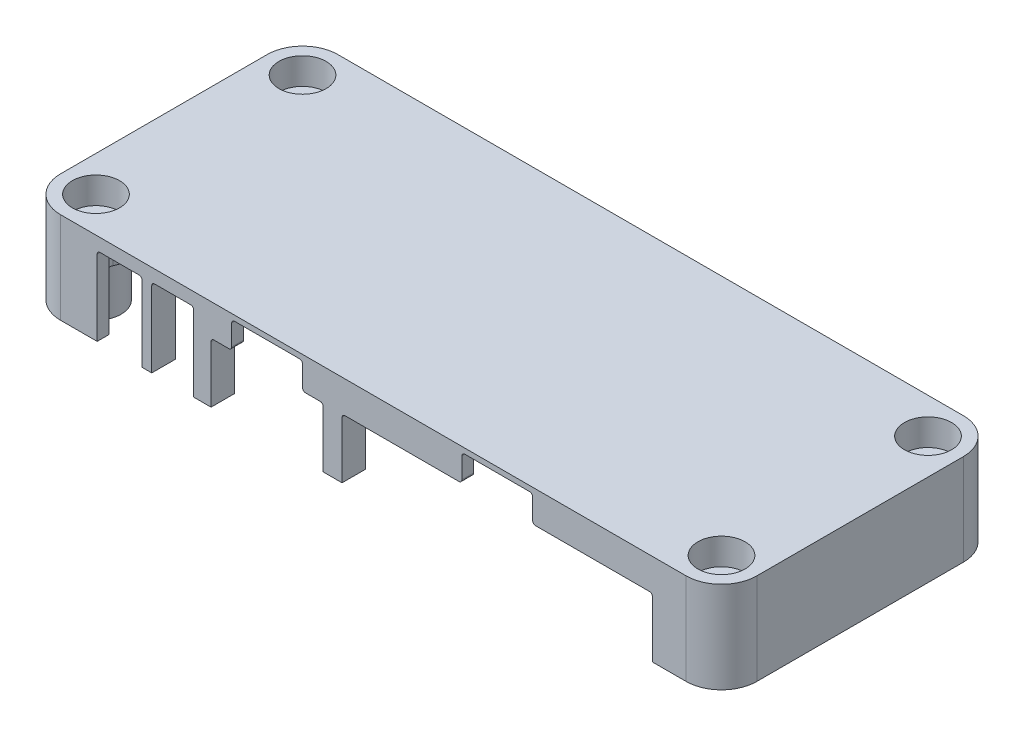
from build123d import *

# Parameters (mm, degrees)
SKETCH1_W           = 118
SKETCH1_H           = 47
BOSS_EXTRUDE1_DEPTH = 15.5
FILLET1_R           = 6
SKETCH4_R           = 2.25
CUT_EXTRUDE1_DEPTH  = 66.37201236
SKETCH7_R           = 4
CUT_EXTRUDE2_DEPTH  = 4.5
CUT_EXTRUDE3_START  = -2
CUT_EXTRUDE3_DEPTH  = 13.5
CUT_EXTRUDE4_START  = -9
CUT_EXTRUDE4_DEPTH  = 9
FILLET2_R           = 1
SKETCH9_W           = 7.6
SKETCH9_H           = 13.3
SKETCH9_W_2         = 7.1
CUT_EXTRUDE5_DEPTH  = 7
SKETCH10_W          = 95.1
SKETCH10_H          = 13.5
CUT_EXTRUDE6_DEPTH  = 20
CUT_EXTRUDE7_REACH  = 74.947
SKETCH14_W          = 0.216079783
SKETCH14_H          = 1.1
FILLET4_R           = 0.5
SKETCH15_W          = 3.2
SKETCH15_H          = 13.5
SKETCH15_W_2        = 1.65
SKETCH15_W_3        = 2.95
BOSS_EXTRUDE2_DEPTH = 2
FILLET11_R          = 0.5


with BuildPart() as part:
    # Sketch1 → Boss-Extrude1 (new body)
    with BuildSketch(Plane(origin=(0, 0, 0), x_dir=(1, 0, 0), z_dir=(0, 1, 0))):
        Rectangle(SKETCH1_W, SKETCH1_H)
    extrude(amount=BOSS_EXTRUDE1_DEPTH)

    # Fillet1
    fillet1_edges = [part.edges().sort_by_distance(p)[0] for p in [
        (59, 7.75, 23.5),
        (-59, 7.75, 23.5),
        (-59, 7.75, -23.5),
        (59, 7.75, -23.5),
    ]]
    fillet(fillet1_edges, radius=FILLET1_R)

    # Sketch4 → Cut-Extrude1 (cut, through all)
    with BuildSketch(Plane(origin=(0, 15.5, 0), x_dir=(1, 0, 0), z_dir=(0, 1, 0))):
        with Locations(Location((53, -17.5, 0), (0, 0, 270))):
            Circle(SKETCH4_R)
        with Locations(Location((-53, -17.5, 0), (0, 0, 90))):
            Circle(SKETCH4_R)
        with Locations(Location((53, 17.5, 0), (0, 0, 90))):
            Circle(SKETCH4_R)
        with Locations(Location((-53, 17.5, 0), (0, 0, 270))):
            Circle(SKETCH4_R)
    extrude(amount=-CUT_EXTRUDE1_DEPTH, mode=Mode.SUBTRACT)

    # Sketch7 → Cut-Extrude2 (cut)
    with BuildSketch(Plane(origin=(0, 15.5, 0), x_dir=(1, 0, 0), z_dir=(0, 1, 0))):
        with Locations(Location((53, 17.5, 0), (0, 0, 270))):
            Circle(SKETCH7_R)
        with Locations(Location((53, -17.5, 0), (0, 0, 90))):
            Circle(SKETCH7_R)
        with Locations(Location((-53, -17.5, 0), (0, 0, 270))):
            Circle(SKETCH7_R)
        with Locations(Location((-53, 17.5, 0), (0, 0, 90))):
            Circle(SKETCH7_R)
    extrude(amount=-CUT_EXTRUDE2_DEPTH, mode=Mode.SUBTRACT)

    # Sketch6 → Cut-Extrude3 (cut)
    with BuildSketch(Plane(origin=(0, 15.5, 0), x_dir=(1, 0, 0), z_dir=(0, 1, 0)).offset(CUT_EXTRUDE3_START)):
        with BuildLine():
            Line((57, 13.027864045), (57, -13.027864045))
            ThreePointArc((57, -13.027864045), (48.757359313, -13.257359313), (48.527864045, -21.5))
            Line((48.527864045, -21.5), (-48.527864045, -21.5))
            ThreePointArc((-48.527864045, -21.5), (-48.757359313, -13.257359313), (-57, -13.027864045))
            Line((-57, -13.027864045), (-57, 13.027864045))
            ThreePointArc((-57, 13.027864045), (-48.757359313, 13.257359313), (-48.527864045, 21.5))
            Line((-48.527864045, 21.5), (48.527864045, 21.5))
            ThreePointArc((48.527864045, 21.5), (48.757359313, 13.257359313), (57, 13.027864045))
        make_face()
    extrude(amount=-CUT_EXTRUDE3_DEPTH, mode=Mode.SUBTRACT)

    # Sketch8 → Cut-Extrude4 (cut)
    with BuildSketch(Plane.XZ.offset(CUT_EXTRUDE4_START)):
        with BuildLine():
            Line((48.527864045, -21.5), (51.563859338, -21.5))
            ThreePointArc((51.563859338, -21.5), (49.99479618, -14.49479618), (57, -16.063859338))
            Line((57, -16.063859338), (57, -13.027864045))
            ThreePointArc((57, -13.027864045), (48.757359313, -13.257359313), (48.527864045, -21.5))
        make_face()
        with BuildLine():
            ThreePointArc((51.563859338, 21.5), (49.99479618, 14.49479618), (57, 16.063859338))
            Line((57, 16.063859338), (57, 13.027864045))
            ThreePointArc((57, 13.027864045), (48.757359313, 13.257359313), (48.527864045, 21.5))
            Line((48.527864045, 21.5), (51.563859338, 21.5))
        make_face()
        with BuildLine():
            Line((-48.527864045, 21.5), (-51.563859338, 21.5))
            ThreePointArc((-51.563859338, 21.5), (-49.99479618, 14.49479618), (-57, 16.063859338))
            Line((-57, 16.063859338), (-57, 13.027864045))
            ThreePointArc((-57, 13.027864045), (-48.757359313, 13.257359313), (-48.527864045, 21.5))
        make_face()
        with BuildLine():
            ThreePointArc((-51.563859338, -21.5), (-49.99479618, -14.49479618), (-57, -16.063859338))
            Line((-57, -16.063859338), (-57, -13.027864045))
            ThreePointArc((-57, -13.027864045), (-48.757359313, -13.257359313), (-48.527864045, -21.5))
            Line((-48.527864045, -21.5), (-51.563859338, -21.5))
        make_face()
    extrude(amount=CUT_EXTRUDE4_DEPTH, mode=Mode.SUBTRACT)

    # Fillet2
    fillet2_edges = [part.edges().sort_by_distance(p)[0] for p in [
        (-51.563859338, 4.5, -21.5),
        (-57, 4.5, -16.063859338),
        (-51.563859338, 4.5, 21.5),
        (-57, 4.5, 16.063859338),
        (51.563859338, 4.5, 21.5),
        (57, 4.5, 16.063859338),
        (57, 4.5, -16.063859338),
        (51.563859338, 4.5, -21.5),
        (48.527864045, 11.25, 21.5),
        (57, 11.25, 13.027864045),
        (57, 11.25, -13.027864045),
        (48.527864045, 11.25, -21.5),
        (-48.527864045, 11.25, -21.5),
        (-57, 11.25, -13.027864045),
        (-57, 11.25, 13.027864045),
        (-48.527864045, 11.25, 21.5),
    ]]
    fillet(fillet2_edges, radius=FILLET2_R)

    # Sketch9 → Cut-Extrude5 (cut)
    with BuildSketch(Plane.XY.offset(23.5)):
        with Locations((-43, 6.65)):
            Rectangle(SKETCH9_W, SKETCH9_H)
        Polygon((47.3, 0), (47.3, 10.1), (27, 10.1), (27, 14.6), (15, 14.6), (15, 10.1), (-5.3, 10.1), (-5.3, 0), align=None)
        with Locations((-34, 6.65)):
            Rectangle(SKETCH9_W_2, SKETCH9_H)
        Polygon((-27.5, 10.1), (-27.5, 0), (-8.5, 0), (-8.5, 10.1), (-12, 10.1), (-12, 14.6), (-24, 14.6), (-24, 10.1), align=None)
    extrude(amount=-CUT_EXTRUDE5_DEPTH, mode=Mode.SUBTRACT)

    # Sketch10 → Cut-Extrude6 (cut)
    with BuildSketch(Plane(origin=(0, 0, -23.5), x_dir=(-1, 0, 0), z_dir=(0, 0, -1))):
        with Locations((0, 6.75)):
            Rectangle(SKETCH10_W, SKETCH10_H)
    extrude(amount=-CUT_EXTRUDE6_DEPTH, mode=Mode.SUBTRACT)

    # Sketch14 → Cut-Extrude7 (cut, up to next)
    with BuildSketch(Plane.XY.offset(16.5), mode=Mode.PRIVATE) as cut_extrude7_sk1:
        with Locations((47.191960109, 9.55)):
            Rectangle(SKETCH14_W, SKETCH14_H)
    cut_extrude7_tool1 = extrude(cut_extrude7_sk1.sketch, amount=-CUT_EXTRUDE7_REACH, mode=Mode.PRIVATE) & part.part
    add(cut_extrude7_tool1.solids().sort_by_distance((47.19196, 9.55, 16.5))[0], mode=Mode.SUBTRACT)

    # Fillet4
    fillet4_edges = [part.edges().sort_by_distance(p)[0] for p in [
        (47.3, 9.55, 21.280980571),
        (47.3, 9.55, 19.3734994),
        (47.55, 11.25, -20.984925759),
        (-47.55, 11.25, -20.984925759),
        (-47.55, 11.25, -20.009482018),
        (-47.55, 11.25, -14.990517982),
        (47.55, 11.25, -14.990517982),
        (47.55, 11.25, -20.009482018),
        (47.3, 9.55, 15.6265006),
    ]]
    fillet(fillet4_edges, radius=FILLET4_R)

    # Sketch15 → Boss-Extrude2 (add)
    with BuildSketch(Plane(origin=(0, 0, 21.5), x_dir=(-1, 0, 0), z_dir=(0, 0, -1))):
        with Locations((6.9, 6.75)):
            Rectangle(SKETCH15_W, SKETCH15_H)
        with Locations((38.375, 6.75)):
            Rectangle(SKETCH15_W_2, SKETCH15_H)
        with Locations((28.975, 6.75)):
            Rectangle(SKETCH15_W_3, SKETCH15_H)
    extrude(amount=BOSS_EXTRUDE2_DEPTH)

    # Fillet11
    fillet11_edges = [part.edges().sort_by_distance(p)[0] for p in [
        (47.3, 10.1, 22.496330367),
        (27, 10.1, 22.5),
        (27, 14.6, 20),
        (27, 14.05, 16.5),
        (27, 13.5, 19),
        (15, 14.05, 16.5),
        (21, 14.6, 16.5),
        (21, 13.5, 16.5),
        (15, 14.6, 20),
        (15, 10.1, 22.5),
        (15, 13.5, 19),
        (-5.3, 10.1, 22.5),
        (-8.5, 10.1, 22.5),
        (-12, 10.1, 22.5),
        (-12, 14.6, 20),
        (-12, 14.05, 16.5),
        (-12, 13.5, 19),
        (-24, 14.05, 16.5),
        (-18, 14.6, 16.5),
        (-18, 13.5, 16.5),
        (-24, 14.6, 20),
        (-24, 10.1, 22.5),
        (-24, 13.5, 19),
        (-27.5, 10.1, 22.5),
        (-30.45, 13.3, 22.5),
        (-37.55, 13.3, 22.5),
        (-39.2, 13.3, 22.5),
        (-46.8, 13.3, 22.496106332),
    ]]
    fillet(fillet11_edges, radius=FILLET11_R)


solid = part.part
